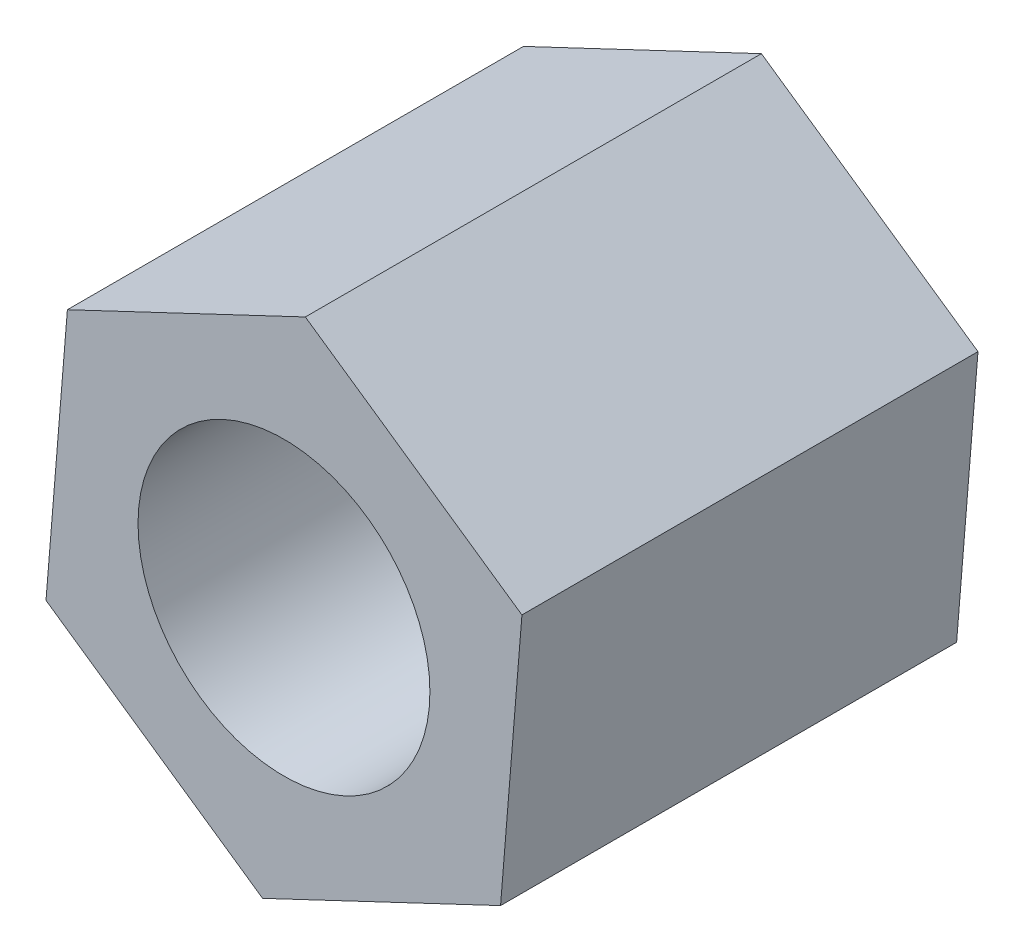
from build123d import *

# Parameters (mm, degrees)
BOSS_EXTRUDE1_DEPTH = 5
SKETCH2_R           = 1.6
CUT_EXTRUDE1_DEPTH  = 5


with BuildPart() as part:
    # Sketch1 → Boss-Extrude1 (new body)
    with BuildSketch(Plane.XY):
        Polygon((-2.374519268, 1.641642951), (-2.608964134, -1.235572533), (-0.234444865, -2.877215483), (2.374519268, -1.641642951), (2.608964134, 1.235572533), (0.234444865, 2.877215483), align=None)
    extrude(amount=BOSS_EXTRUDE1_DEPTH)

    # Sketch2 → Cut-Extrude1 (cut)
    with BuildSketch(Plane.XY.offset(5)):
        Circle(SKETCH2_R)
    extrude(amount=-CUT_EXTRUDE1_DEPTH, mode=Mode.SUBTRACT)


solid = part.part
